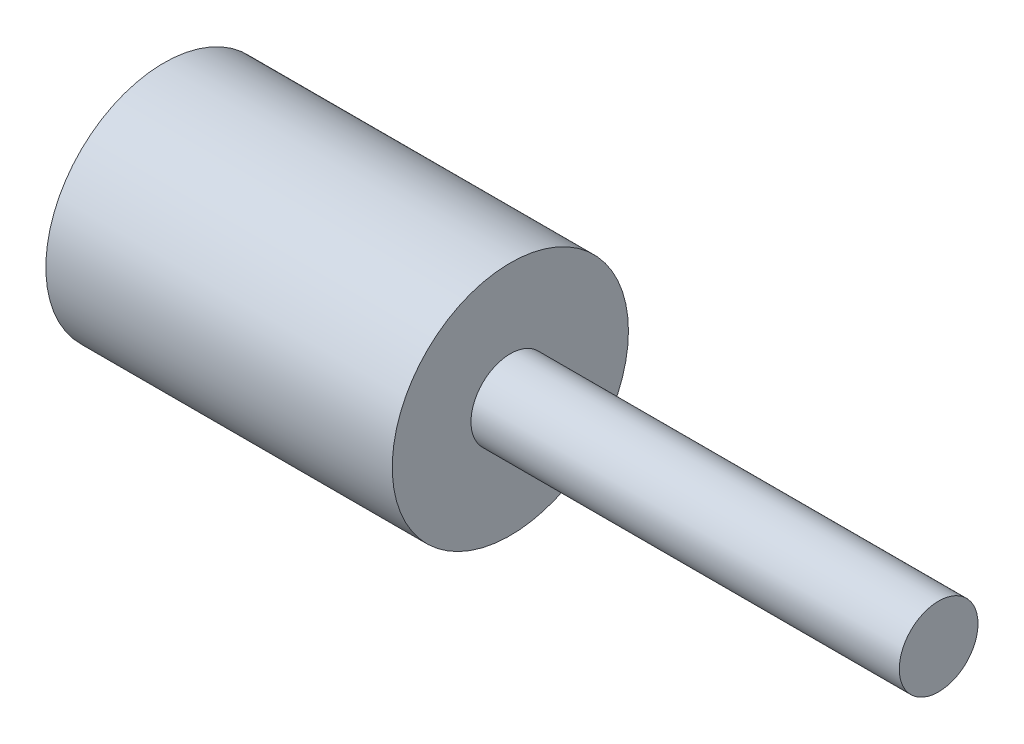
from build123d import *

# Parameters (mm, degrees)
SKETCH2_R          = 3.75
CUT_EXTRUDE1_DEPTH = 15
SKETCH3_R          = 1.5
CUT_EXTRUDE2_DEPTH = 10
FILLET1_R          = 0.5


with BuildPart() as part:
    # Sketch1 → Revolve1 (revolve)
    with BuildSketch(Plane(origin=(0, 0, 0), x_dir=(1, 0, 0), z_dir=(0, 1, 0))):
        Polygon((0, 0), (0, 7.5), (22, 7.5), (22, 2.5), (49.2, 2.5), (49.2, 0), align=None)
    revolve(axis=Axis((49.2, 0, 0), (-1, 0, 0)))

    # Sketch2 → Cut-Extrude1 (cut)
    with BuildSketch(Plane.ZY):
        Circle(SKETCH2_R)
    extrude(amount=-CUT_EXTRUDE1_DEPTH, mode=Mode.SUBTRACT)

    # Sketch3 → Cut-Extrude2 (cut)
    with BuildSketch(Plane.XY):
        with Locations((4.905983841, 0)):
            Circle(SKETCH3_R)
    extrude(amount=-CUT_EXTRUDE2_DEPTH, mode=Mode.SUBTRACT)

    # Fillet1
    fillet1_edges = [part.edges().sort_by_distance(p)[0] for p in [
        (4.905983841, 1.5, -7.348469228),
    ]]
    fillet(fillet1_edges, radius=FILLET1_R)


solid = part.part
